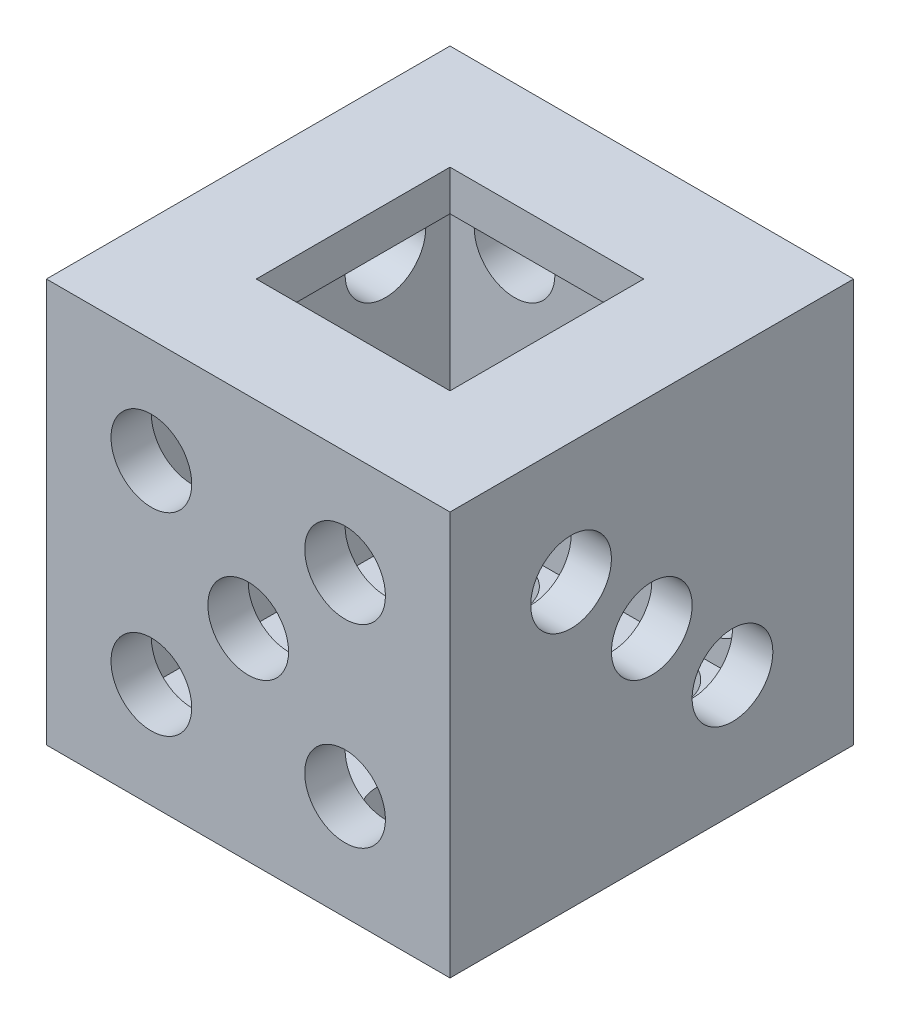
from build123d import *

# Parameters (mm, degrees)
SKETCH1_W           = 25
SKETCH1_H           = 25
BOSS_EXTRUDE1_DEPTH = 25
SHELL1_T            = 2.5
SKETCH2_W           = 12
SKETCH2_H           = 12
CUT_EXTRUDE1_DEPTH  = 15
SKETCH3_R           = 2.5
CUT_EXTRUDE2_DEPTH  = 15
SKETCH4_R           = 2.5
CUT_EXTRUDE6_DEPTH  = 15
SKETCH4_3_R         = 2.5
CUT_EXTRUDE7_DEPTH  = 15
SKETCH5_R           = 2.5
CUT_EXTRUDE8_DEPTH  = 15
SKETCH5_4_R         = 2.5
CUT_EXTRUDE9_DEPTH  = 15
SKETCH5_5_R         = 2.5
CUT_EXTRUDE10_DEPTH = 15
SKETCH7_R           = 2.5
CUT_EXTRUDE11_DEPTH = 15
CUT_EXTRUDE12_START = -15
SKETCH8_R           = 2.5
CUT_EXTRUDE12_DEPTH = 15


with BuildPart() as part:
    # Sketch1 → Boss-Extrude1 (new body)
    with BuildSketch(Plane(origin=(0, 0, 0), x_dir=(1, 0, 0), z_dir=(0, 1, 0))):
        Rectangle(SKETCH1_W, SKETCH1_H)
    extrude(amount=BOSS_EXTRUDE1_DEPTH)

    # Shell1 (no face opened: a closed hollow body)
    add(offset(amount=-SHELL1_T, mode=Mode.PRIVATE), mode=Mode.SUBTRACT)

    # Sketch2 → Cut-Extrude1 (cut)
    with BuildSketch(Plane(origin=(0, 25, 0), x_dir=(1, 0, 0), z_dir=(0, 1, 0))):
        Rectangle(SKETCH2_W, SKETCH2_H)
    extrude(amount=-CUT_EXTRUDE1_DEPTH, mode=Mode.SUBTRACT)

    # Sketch3 → Cut-Extrude2 (cut)
    with BuildSketch(Plane.XZ):
        with Locations((-5, 7)):
            Circle(SKETCH3_R)
        with Locations((-5, 0)):
            Circle(SKETCH3_R)
        with Locations((-5, -7)):
            Circle(SKETCH3_R)
        with Locations((5, 7)):
            Circle(SKETCH3_R)
        with Locations((5, 0)):
            Circle(SKETCH3_R)
        with Locations((5, -7)):
            Circle(SKETCH3_R)
    extrude(amount=-CUT_EXTRUDE2_DEPTH, mode=Mode.SUBTRACT)

    # Sketch4 → Cut-Extrude6 (cut)
    with BuildSketch(Plane(origin=(12.5, 0, 0), x_dir=(0, 0, -1), z_dir=(1, 0, 0))):
        with Locations((-5, 17.5)):
            Circle(SKETCH4_R)
    extrude(amount=-CUT_EXTRUDE6_DEPTH, mode=Mode.SUBTRACT)

    # Sketch4<3> → Cut-Extrude7 (cut)
    with BuildSketch(Plane(origin=(12.5, 0, 0), x_dir=(0, 0, -1), z_dir=(1, 0, 0))):
        with Locations((0, 12.5)):
            Circle(SKETCH4_3_R)
        with Locations((5, 7.5)):
            Circle(SKETCH4_3_R)
    extrude(amount=-CUT_EXTRUDE7_DEPTH, mode=Mode.SUBTRACT)

    # Sketch5 → Cut-Extrude8 (cut)
    with BuildSketch(Plane.ZY.offset(12.5)):
        with Locations((-6, 18.5)):
            Circle(SKETCH5_R)
    extrude(amount=-CUT_EXTRUDE8_DEPTH, mode=Mode.SUBTRACT)

    # Sketch5<4> → Cut-Extrude9 (cut)
    with BuildSketch(Plane.ZY.offset(12.5)):
        with Locations((6, 18.5)):
            Circle(SKETCH5_4_R)
    extrude(amount=-CUT_EXTRUDE9_DEPTH, mode=Mode.SUBTRACT)

    # Sketch5<5> → Cut-Extrude10 (cut)
    with BuildSketch(Plane.ZY.offset(12.5)):
        with Locations((6, 6.5)):
            Circle(SKETCH5_5_R)
        with Locations((-6, 6.5)):
            Circle(SKETCH5_5_R)
    extrude(amount=-CUT_EXTRUDE10_DEPTH, mode=Mode.SUBTRACT)

    # Sketch7 → Cut-Extrude11 (cut)
    with BuildSketch(Plane.XY.offset(12.5)):
        with Locations((-6, 18.5)):
            Circle(SKETCH7_R)
        with Locations((0, 12.5)):
            Circle(SKETCH7_R)
        with Locations((6, 18.5)):
            Circle(SKETCH7_R)
        with Locations((6, 6.5)):
            Circle(SKETCH7_R)
        with Locations((-6, 6.5)):
            Circle(SKETCH7_R)
    extrude(amount=-CUT_EXTRUDE11_DEPTH, mode=Mode.SUBTRACT)

    # Sketch8 → Cut-Extrude12 (cut)
    with BuildSketch(Plane(origin=(0, 0, -12.5), x_dir=(-1, 0, 0), z_dir=(0, 0, -1)).offset(CUT_EXTRUDE12_START)):
        with Locations((6, 18.5)):
            Circle(SKETCH8_R)
        with Locations((-6, 6.5)):
            Circle(SKETCH8_R)
    extrude(amount=CUT_EXTRUDE12_DEPTH, mode=Mode.SUBTRACT)


solid = part.part
